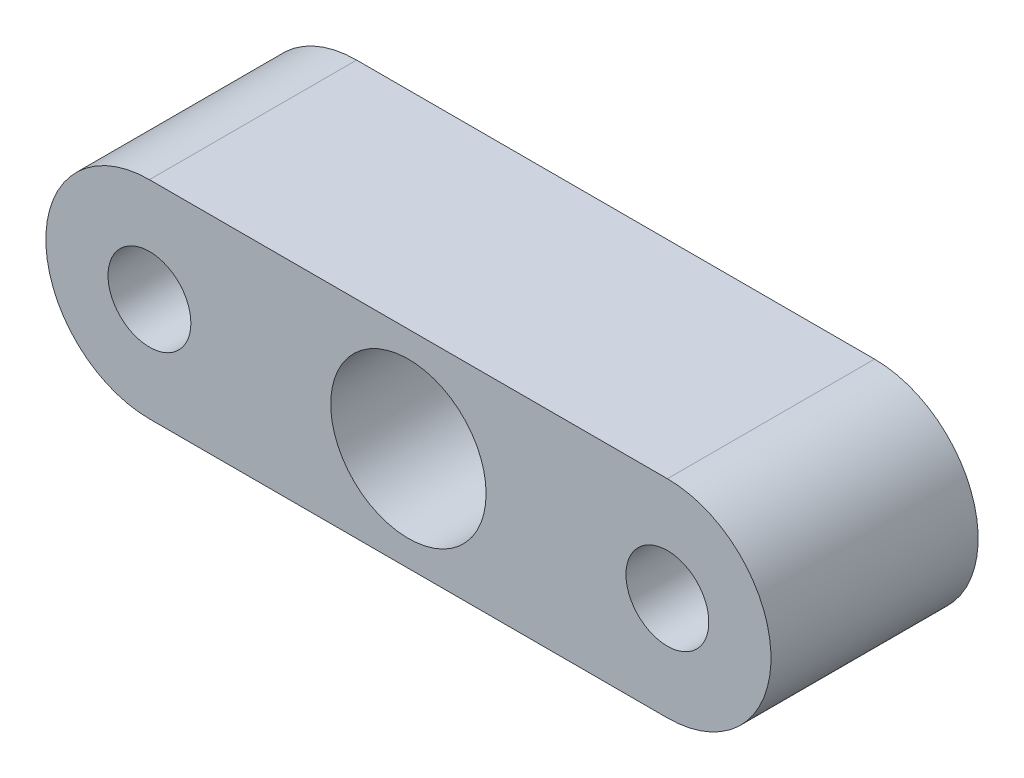
from build123d import *

# Parameters (mm, degrees)
SKETCH_1_R      = 7.5
SKETCH_1_R_2    = 4
EXTRUDE_1_DEPTH = 20


with BuildPart() as part:
    # 草图1 → 凸台-拉伸1 (new body)
    with BuildSketch(Plane.XY):
        with BuildLine():
            Line((-25, 10), (25, 10))
            ThreePointArc((25, 10), (35, 0), (25, -10))
            Line((25, -10), (-25, -10))
            ThreePointArc((-25, -10), (-35, 0), (-25, 10))
        make_face()
        Circle(SKETCH_1_R, mode=Mode.SUBTRACT)
        with Locations((-25, 0)):
            Circle(SKETCH_1_R_2, mode=Mode.SUBTRACT)
        with Locations(Location((25, 0, 0), (0, 0, 180))):
            Circle(SKETCH_1_R_2, mode=Mode.SUBTRACT)
    extrude(amount=EXTRUDE_1_DEPTH)


solid = part.part
